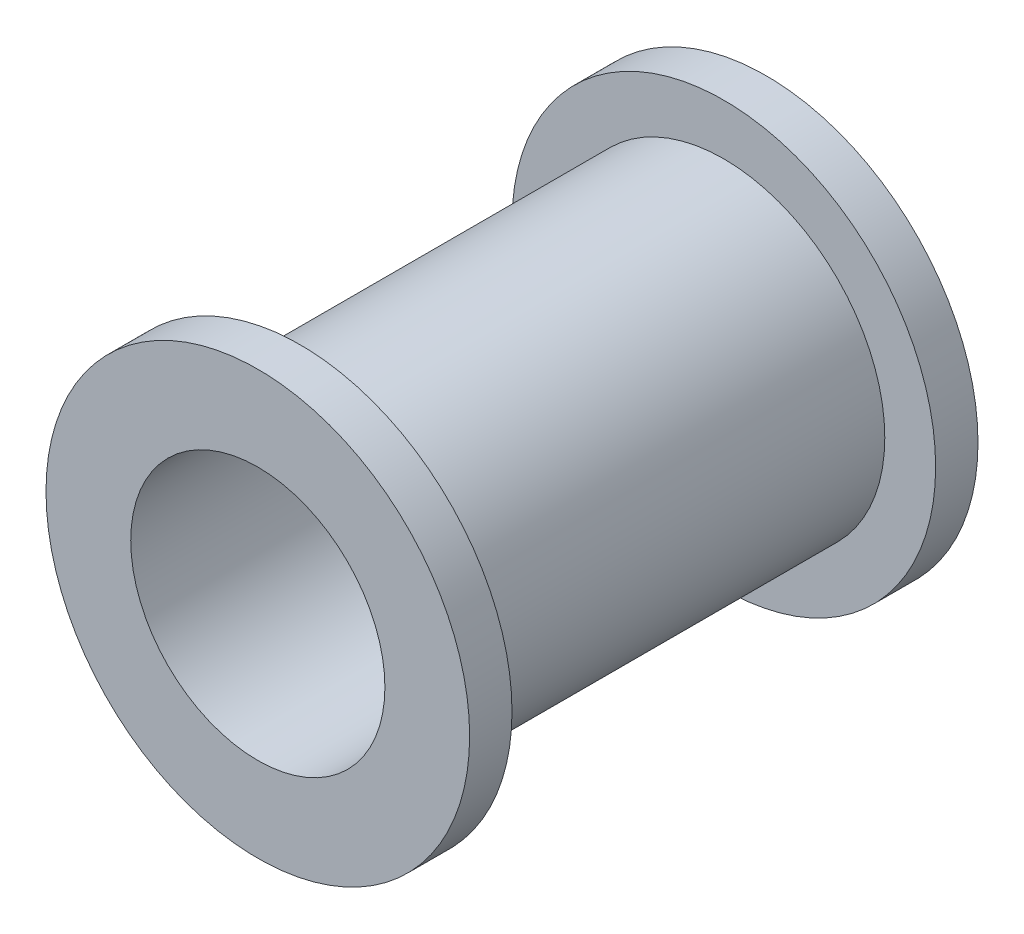
from build123d import *

# Parameters (mm, degrees)
SKETCH1_R           = 19
SKETCH1_R_2         = 15
BOSS_EXTRUDE1_DEPTH = 50
SKETCH2_R           = 25
SKETCH2_R_2         = 15
BOSS_EXTRUDE2_DEPTH = 5
BOSS_EXTRUDE3_START = 5
SKETCH4_R           = 25
SKETCH4_R_2         = 15
BOSS_EXTRUDE3_DEPTH = 5


with BuildPart() as part:
    # Sketch1 → Boss-Extrude1 (new body)
    with BuildSketch(Plane.XY):
        Circle(SKETCH1_R)
        Circle(SKETCH1_R_2, mode=Mode.SUBTRACT)
    extrude(amount=BOSS_EXTRUDE1_DEPTH)

    # Sketch2 → Boss-Extrude2 (add)
    with BuildSketch(Plane.XY.offset(50)):
        Circle(SKETCH2_R)
        Circle(SKETCH2_R_2, mode=Mode.SUBTRACT)
    extrude(amount=BOSS_EXTRUDE2_DEPTH)

    # Sketch4 → Boss-Extrude3 (add)
    with BuildSketch(Plane(origin=(0, 0, 0), x_dir=(-1, 0, 0), z_dir=(0, 0, -1)).offset(BOSS_EXTRUDE3_START)):
        with Locations(Location((0, 0, 0), (0, 0, 180))):
            Circle(SKETCH4_R)
        Circle(SKETCH4_R_2, mode=Mode.SUBTRACT)
    extrude(amount=-BOSS_EXTRUDE3_DEPTH)


solid = part.part
